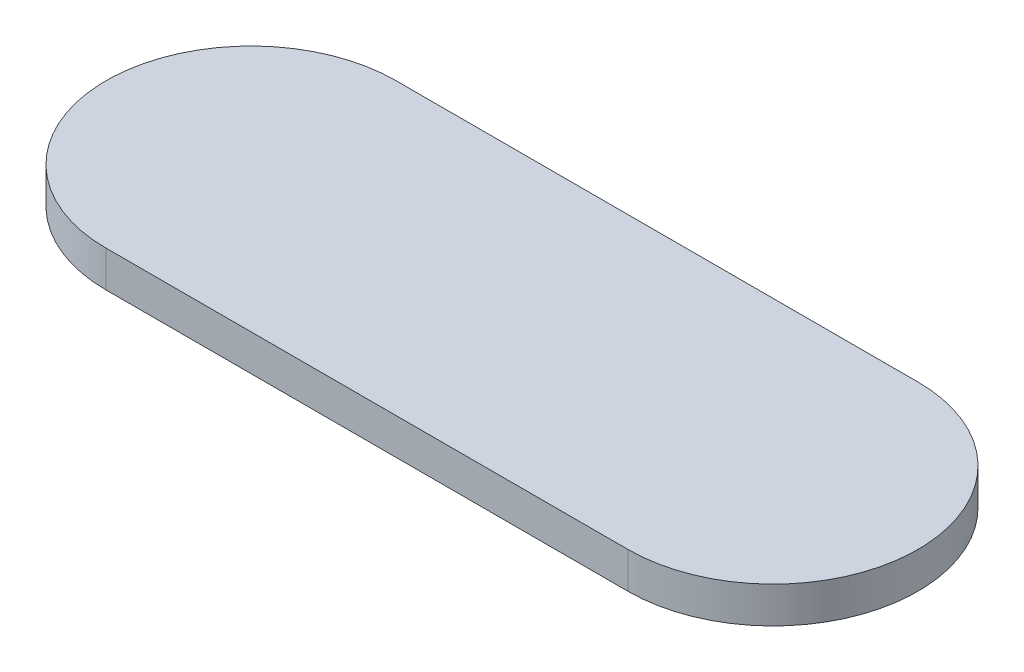
from build123d import *

# Parameters (mm, degrees)
BOSS_EXTRUDE1_DEPTH = 1.5875


with BuildPart() as part:
    # Sketch1 → Boss-Extrude1 (new body)
    with BuildSketch(Plane(origin=(0, 0, 0), x_dir=(1, 0, 0), z_dir=(0, 1, 0))):
        with BuildLine():
            Line((-11.43, 6.35), (11.43, 6.35))
            ThreePointArc((11.43, 6.35), (17.78, 0), (11.43, -6.35))
            Line((11.43, -6.35), (-11.43, -6.35))
            ThreePointArc((-11.43, -6.35), (-17.78, 0), (-11.43, 6.35))
        make_face()
    extrude(amount=BOSS_EXTRUDE1_DEPTH)


solid = part.part
